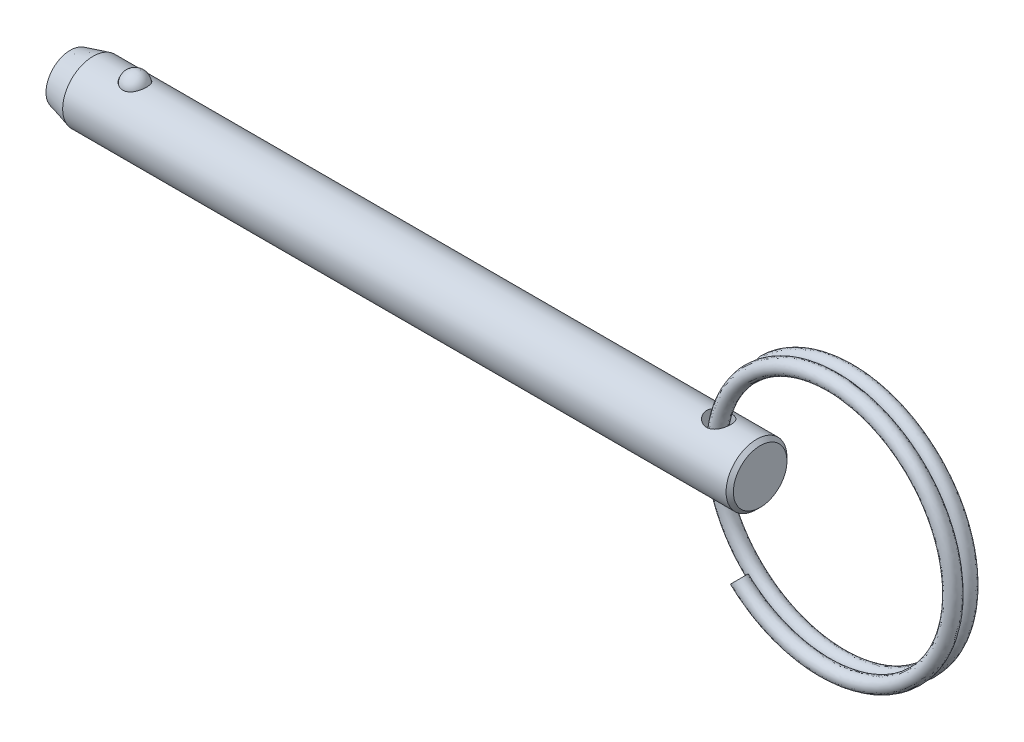
from build123d import *

# Parameters (mm, degrees)
SKETCH4_W          = 1.27
SKETCH4_H          = 6.35
SWEEP1_PITCH       = 1.5494
SWEEP1_HEIGHT      = 1.355725
SWEEP1_RADIUS      = 13.462
SKETCH6_R          = 0.762
SWEEP2_PITCH       = 1.5494
SWEEP2_HEIGHT      = 1.355725
SWEEP2_RADIUS      = 13.462
SWEEP2_START_ANGLE = -180
SKETCH6_2_R        = 0.762


with BuildPart() as part:
    # Sketch1 → Revolve1 (revolve)
    with BuildSketch(Plane.XY, mode=Mode.PRIVATE) as revolve1_sk:
        Polygon((35.9664, 2.794), (35.5854, 3.175), (-33.596547737, 3.175), (-35.9664, 2.54), (-35.9664, 0), (35.9664, 0), align=None)
    revolve(revolve1_sk.sketch.rotate(Axis((35.9664, 0, 0), (1, 0, 0)), 90), axis=Axis((35.9664, 0, 0), (1, 0, 0)))

    # Sketch2 → Cut-Revolve1 (revolve, cut)
    with BuildSketch(Plane.XY):
        with BuildLine():
            Line((-27.974582051, 2.8575), (-30.489182051, 2.8575))
            ThreePointArc((-30.489182051, 2.8575), (-29.231882051, 4.1148), (-27.974582051, 2.8575))
        make_face()
    revolve(axis=Axis((-27.974582051, 2.8575, 0), (1, 0, 0)), mode=Mode.SUBTRACT)

    # Sketch4 → Cut-Revolve2 (revolve, cut)
    with BuildSketch(Plane.XY, mode=Mode.PRIVATE) as cut_revolve2_sk:
        with Locations((32.2834, 0)):
            Rectangle(SKETCH4_W, SKETCH4_H)
    revolve(cut_revolve2_sk.sketch.rotate(Axis((31.6484, -3.175, 0), (0, 1, 0)), 90), axis=Axis((31.6484, -3.175, 0), (0, 1, 0)), mode=Mode.SUBTRACT)


with BuildPart() as body_2:
    # Sketch3 → Revolve2 (revolve)
    with BuildSketch(Plane.XY):
        with BuildLine():
            Line((-27.999982051, 2.8575), (-30.463782051, 2.8575))
            ThreePointArc((-30.463782051, 2.8575), (-29.231882051, 4.0894), (-27.999982051, 2.8575))
        make_face()
    revolve(axis=Axis((-27.999982051, 2.8575, 0), (1, 0, 0)))


with BuildPart() as body_3:
    # Sweep1: sweep along a helix
    with BuildLine() as sweep1_path:
        Helix(SWEEP1_PITCH, SWEEP1_HEIGHT, SWEEP1_RADIUS, center=(44.133425091, 0, 0), direction=(0, 0, -1), lefthand=True)
    # Sketch6 → Sweep1 (sweep)
    with BuildSketch(Plane(origin=(114.003847968, 0, 0), x_dir=(0, 0, -1), z_dir=(0, 1, 0))):
        with Locations((0, 82.570422877)):
            Circle(SKETCH6_R)
    sweep(path=sweep1_path.line, is_frenet=True)

    # Sweep2: sweep along a helix
    with BuildLine() as sweep2_path:
        add(Helix(SWEEP2_PITCH, SWEEP2_HEIGHT, SWEEP2_RADIUS, center=(44.133425091, 0, 0), direction=(0, 0, 1), lefthand=True, mode=Mode.PRIVATE).rotate(Axis((44.133425091, 0, 0), (0, 0, 1)), SWEEP2_START_ANGLE))
    # Sketch6<2> → Sweep2 (sweep)
    with BuildSketch(Plane(origin=(114.003847968, 0, 0), x_dir=(0, 0, -1), z_dir=(0, 1, 0))):
        with Locations((0, 82.570422877)):
            Circle(SKETCH6_2_R)
    sweep(path=sweep2_path.line, is_frenet=True)


solid = Compound([part.part, body_2.part, body_3.part])
